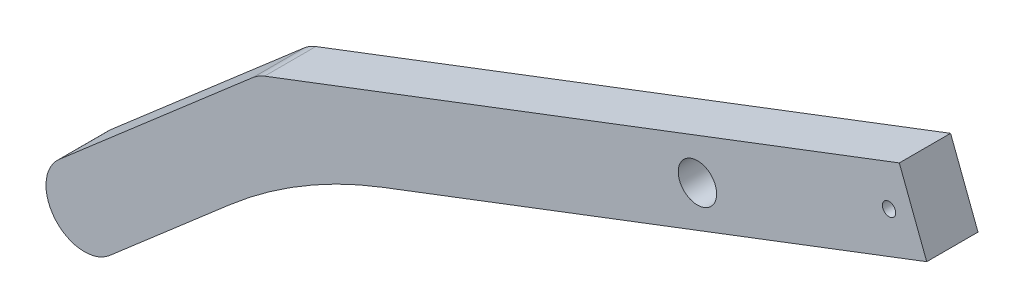
from build123d import *

# Parameters (mm, degrees)
SKETCH_1_R      = 2.6
SKETCH_1_R_2    = 7.5
EXTRUDE_1_DEPTH = 20


with BuildPart() as part:
    # 草图1 → 凸台-拉伸1 (new body)
    with BuildSketch(Plane.XY):
        with BuildLine():
            Line((-90.182622834, -3.687217222), (-165.784023014, -69.142761608))
            ThreePointArc((-165.784023014, -69.142761608), (-167.305901383, -90.301303292), (-146.147359698, -91.823181662))
            Line((-146.147359698, -91.823181662), (-99.206677775, -51.182031077))
            ThreePointArc((-99.206677775, -51.182031077), (-70.96175344, -30.746669364), (-39.59736965, -15.526446352))
            Line((-39.59736965, -15.526446352), (172.570702611, 65.433053226))
            Line((172.570702611, 65.433053226), (161.875435514, 93.461810989))
            Line((161.875435514, 93.461810989), (-85.711924724, -1.013048368))
            ThreePointArc((-85.711924724, -1.013048368), (-88.064253508, -2.154565094), (-90.182622834, -3.687217222))
        make_face()
        with Locations((157.880149808, 75.882343075)):
            Circle(SKETCH_1_R, mode=Mode.SUBTRACT)
        with Locations((83.136795774, 47.361630817)):
            Circle(SKETCH_1_R_2, mode=Mode.SUBTRACT)
    extrude(amount=EXTRUDE_1_DEPTH)


solid = part.part
